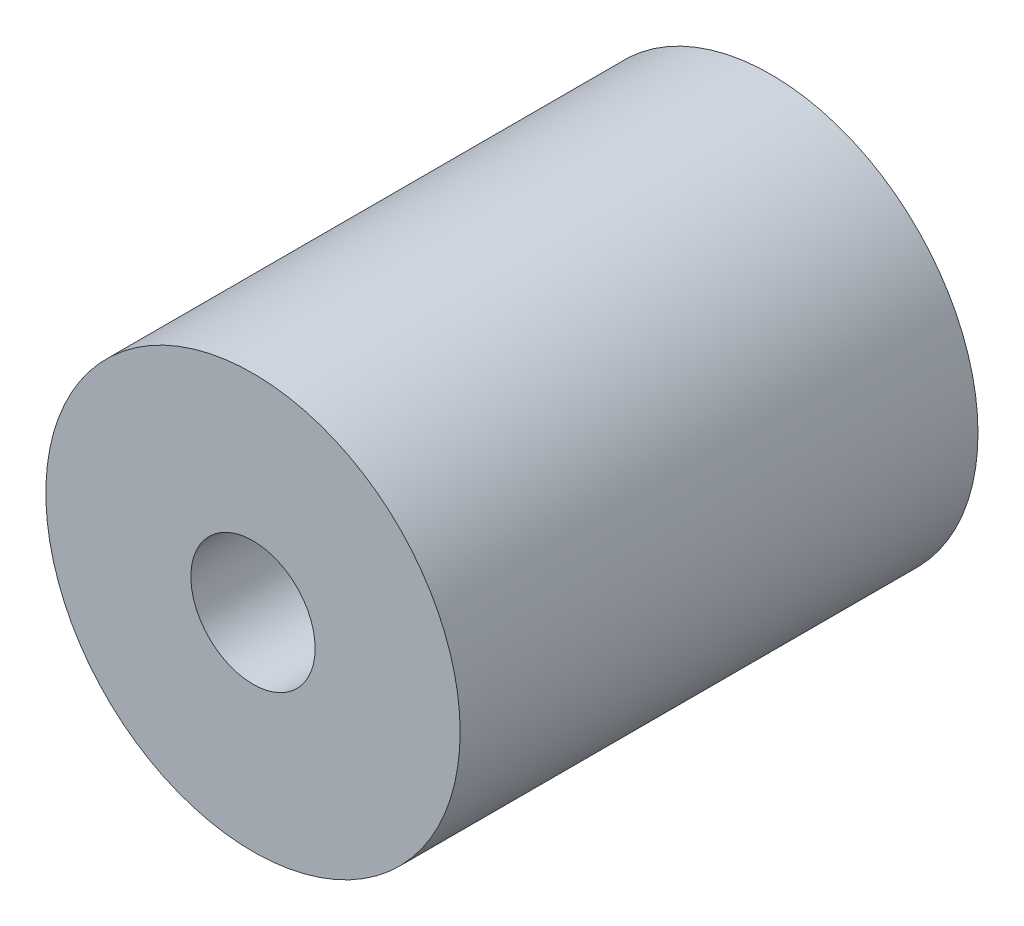
from build123d import *

# Parameters (mm, degrees)
SKETCH1_R           = 10
BOSS_EXTRUDE1_DEPTH = 25
SKETCH2_R           = 3
CUT_EXTRUDE1_DEPTH  = 25
SKETCH3_R           = 4
CUT_EXTRUDE2_DEPTH  = 12.5


with BuildPart() as part:
    # Sketch1 → Boss-Extrude1 (new body)
    with BuildSketch(Plane(origin=(0, 0, 0), x_dir=(0, 1, 0), z_dir=(0, 0, 1))):
        with Locations(Location((0, 0, 0), (0, 0, 270))):
            Circle(SKETCH1_R)
    extrude(amount=BOSS_EXTRUDE1_DEPTH)

    # Sketch2 → Cut-Extrude1 (cut)
    with BuildSketch(Plane.XY.offset(25)):
        Circle(SKETCH2_R)
    extrude(amount=-CUT_EXTRUDE1_DEPTH, mode=Mode.SUBTRACT)

    # Sketch3 → Cut-Extrude2 (cut)
    with BuildSketch(Plane(origin=(0, 0, 0), x_dir=(1, 0, 0), z_dir=(0, 0, -1))):
        with Locations(Location((0, 0, 0), (0, 0, 180))):
            Circle(SKETCH3_R)
    extrude(amount=-CUT_EXTRUDE2_DEPTH, mode=Mode.SUBTRACT)


solid = part.part
